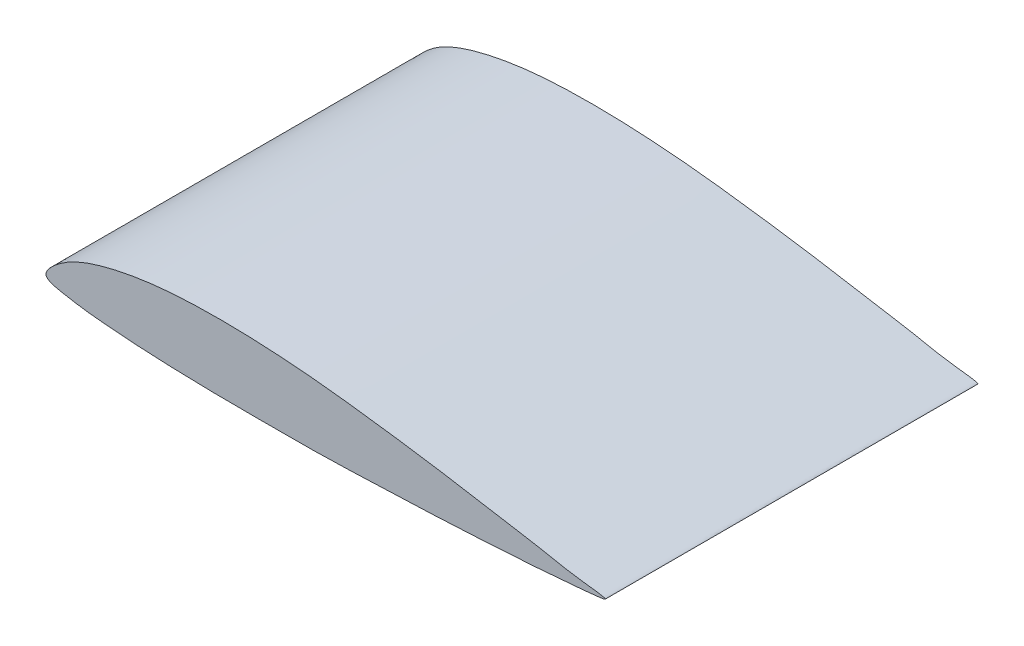
from build123d import *

# Parameters (mm, degrees)
EXTRUDE_1_DEPTH = 100


with BuildPart() as part:
    # Эскиз1 → Бобышка-Вытянуть1 (new body)
    with BuildSketch(Plane.XY):
        with BuildLine():
            add(Edge.make_bspline(
                [(150, 0), (150.008053425, 0.37297404), (141.345567832, 1.166887718), (133.169926283, 3.031440417), (119.777902198, 5.126602536), (105.089952049, 7.74269609), (90.002967054, 9.870394209), (75.038511916, 11.79681884), (60.020353695, 13.033629458), (44.99943153, 13.461358753), (32.449953449, 12.959683613), (22.450633398, 11.584243585), (16.175958263, 10.205371891), (11.214367567, 8.693122576), (7.271330698, 7.082239733), (3.57694045, 4.971328303), (-2.295689364, -0.185353368), (3.94718611, -1.665241232), (7.415786492, -2.245837267), (11.258482782, -2.829948252), (16.235572441, -3.279531548), (22.497013392, -3.80145), (32.491707012, -4.341722715), (44.998527157, -4.687932479), (59.998300892, -4.695504237), (75.009590768, -4.700050605), (89.984888026, -4.043805744), (105.063655313, -3.514222944), (119.788434236, -2.687996782), (133.147962552, -1.832620712), (141.401997202, -1.066450228), (149.99197874, -0.371484406), (150, 0)],
                knots=[0, 0, 0, 0, 0.024871717, 0.04982575, 0.099674055, 0.149481082, 0.199113443, 0.248602294, 0.297881852, 0.347017138, 0.396197185, 0.420996043, 0.44616399, 0.459027461, 0.472308503, 0.486628938, 0.506691322, 0.520010096, 0.532487113, 0.544893447, 0.557234365, 0.581872173, 0.606469995, 0.655609333, 0.704728634, 0.753848524, 0.802997287, 0.852155254, 0.901345504, 0.950577623, 0.975227619, 1, 1, 1, 1], degree=3))
        make_face()
    extrude(amount=EXTRUDE_1_DEPTH)


solid = part.part
